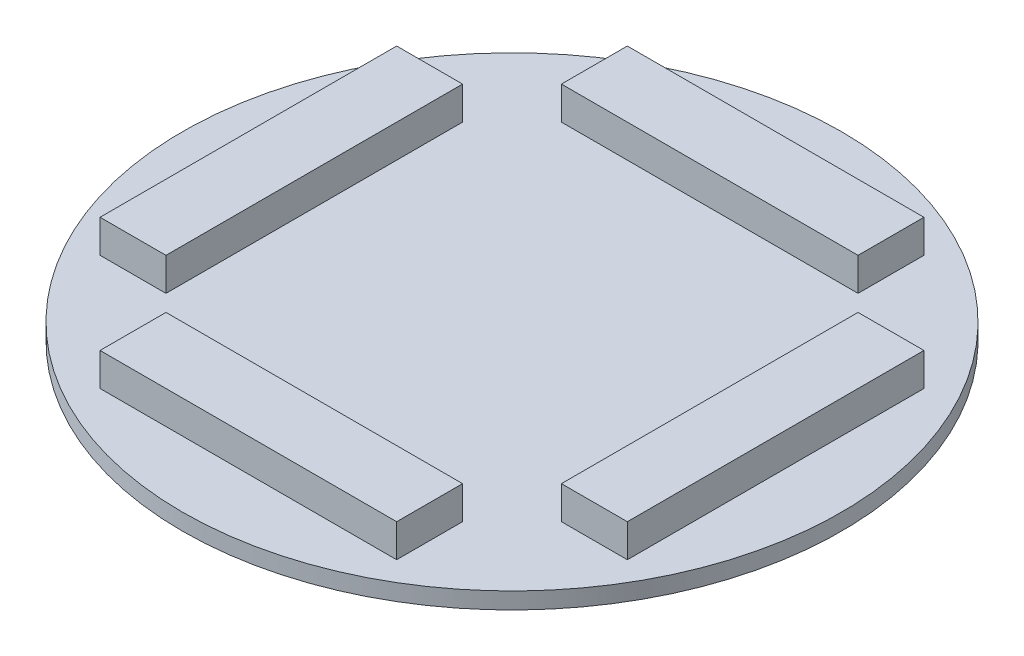
from build123d import *

# Parameters (mm, degrees)
SKETCH1_R                    = 20
PCB_DEPTH                    = 1
SKETCH2_W                    = 18
SKETCH2_H                    = 4
HIROSE_CONNECTOR_STACK_DEPTH = 2
CIRPATTERN1_COUNT            = 4


with BuildPart() as part:
    # Sketch1 → PCB (new body)
    with BuildSketch(Plane(origin=(0, 0, 0), x_dir=(1, 0, 0), z_dir=(0, 1, 0))):
        with Locations(Location((0, 0, 0), (0, 0, 270))):
            Circle(SKETCH1_R)
    extrude(amount=PCB_DEPTH)

    # Sketch2 → Hirose Connector Stack (add)
    with BuildSketch(Plane(origin=(0, 1, 0), x_dir=(1, 0, 0), z_dir=(0, 1, 0))):
        with Locations((0, 14)):
            Rectangle(SKETCH2_W, SKETCH2_H)
    hirose_connector_stack = extrude(amount=HIROSE_CONNECTOR_STACK_DEPTH)

    # CirPattern1: Hirose Connector Stack ×4 about axis
    cirpattern1_axis = Axis((0, 0, 0), (0, 1, 0))
    for i in range(1, CIRPATTERN1_COUNT):
        add(hirose_connector_stack.rotate(cirpattern1_axis, i * 360 / CIRPATTERN1_COUNT))


solid = part.part
